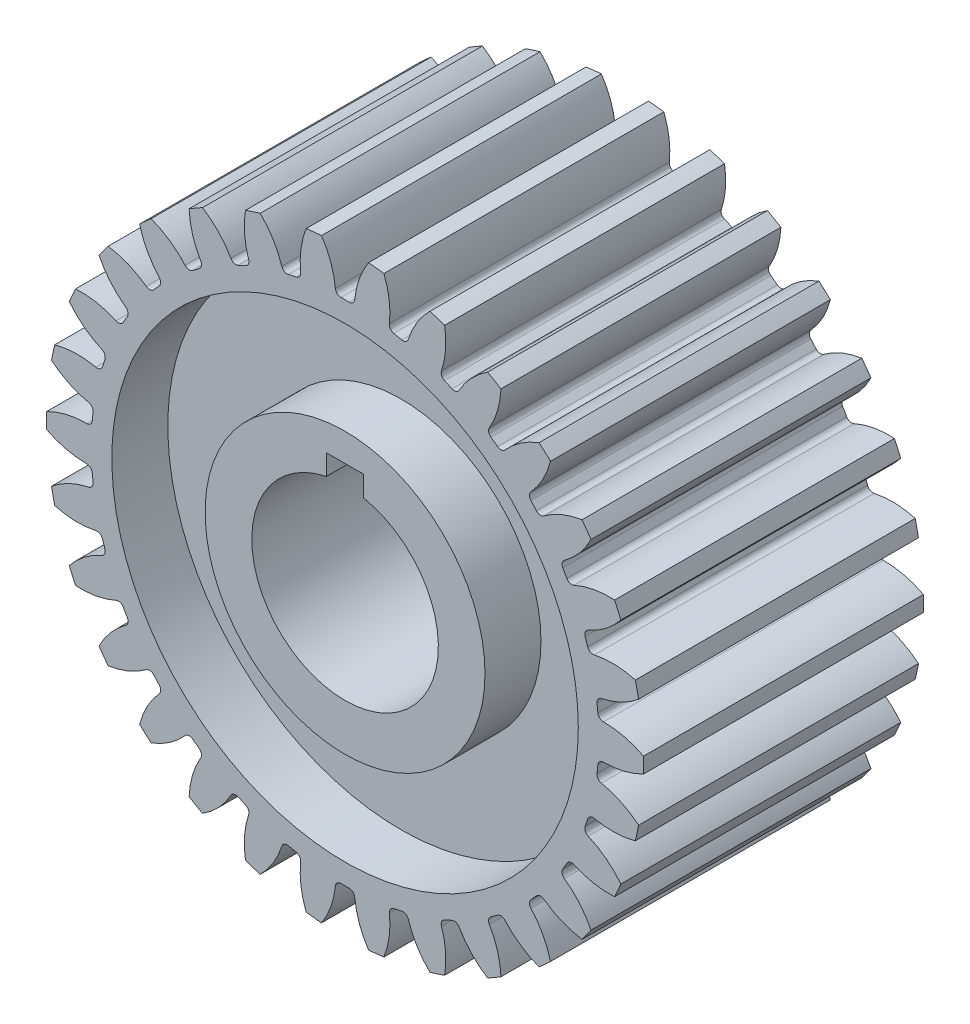
from build123d import *

# Parameters (mm, degrees)
SKETCH1_R           = 16
BOSS_EXTRUDE1_DEPTH = 7.5
CUT_EXTRUDE1_DEPTH  = 28.147743921
SKETCH3_R           = 12.5
SKETCH3_R_2         = 7.5
CUT_EXTRUDE2_DEPTH  = 3
CUT_EXTRUDE3_DEPTH  = 28.147743921
CIRPATTERN1_COUNT   = 30


with BuildPart() as part:
    # Sketch1 → Boss-Extrude1 (new, symmetric)
    with BuildSketch(Plane.XY):
        Circle(SKETCH1_R)
    extrude(amount=BOSS_EXTRUDE1_DEPTH, both=True)

    # Sketch2 → Cut-Extrude1 (cut, through all)
    with BuildSketch(Plane.XY.offset(7.5)):
        with BuildLine():
            Line((-1, 6), (1, 6))
            Line((1, 6), (1, 4.898979486))
            ThreePointArc((1, 4.898979486), (0, -5), (-1, 4.898979486))
            Line((-1, 4.898979486), (-1, 6))
        make_face()
    extrude(amount=-CUT_EXTRUDE1_DEPTH, mode=Mode.SUBTRACT)

    # Sketch3 → Cut-Extrude2 (cut)
    with BuildSketch(Plane.XY.offset(7.5)):
        Circle(SKETCH3_R)
        Circle(SKETCH3_R_2, mode=Mode.SUBTRACT)
    cut_extrude2 = extrude(amount=-CUT_EXTRUDE2_DEPTH, mode=Mode.SUBTRACT)

    # Mirror1: Cut-Extrude2 across plane
    add(cut_extrude2.mirror(Plane.XY), mode=Mode.SUBTRACT)

    # Sketch4 → Cut-Extrude3 (cut, through all)
    with BuildSketch(Plane.XY.offset(7.5)):
        with BuildLine():
            Line((-0.219874756, 13.6), (0.219874756, 13.6))
            ThreePointArc((0.219874756, 13.6), (0.421386888, 13.677754953), (0.518441911, 13.870714262))
            ThreePointArc((0.518441911, 13.870714262), (1.009154991, 15.525876188), (2.08, 16.88))
            ThreePointArc((2.08, 16.88), (0, 17.000581665), (-2.08, 16.88))
            ThreePointArc((-2.08, 16.88), (-1.009154991, 15.525876188), (-0.518441911, 13.870714262))
            ThreePointArc((-0.518441911, 13.870714262), (-0.421386888, 13.677754953), (-0.219874756, 13.6))
        make_face()
    cut_extrude3 = extrude(amount=-CUT_EXTRUDE3_DEPTH, mode=Mode.SUBTRACT)

    # CirPattern1: Cut-Extrude3 ×30 about axis
    cirpattern1_axis = Axis((0, 0, 0), (0, 0, 1))
    for i in range(1, CIRPATTERN1_COUNT):
        add(cut_extrude3.rotate(cirpattern1_axis, i * 360 / CIRPATTERN1_COUNT), mode=Mode.SUBTRACT)


solid = part.part
